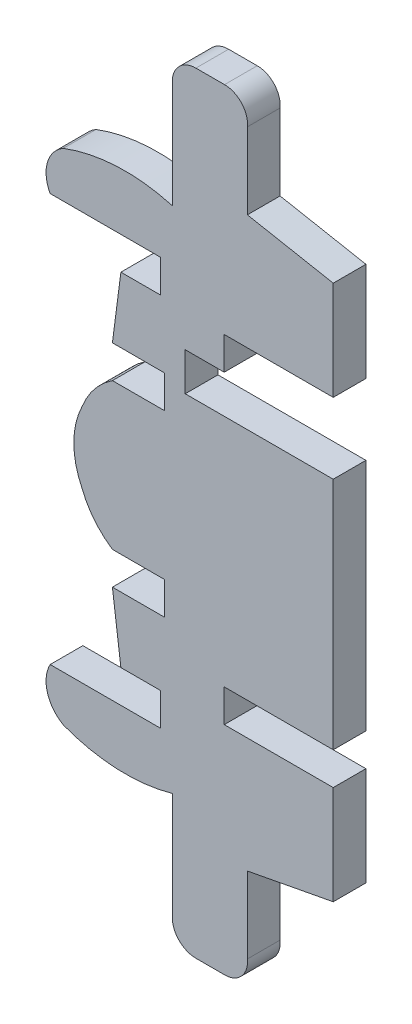
from build123d import *

# Parameters (mm, degrees)
BASE_EXTRUDE_DEPTH = 3


with BuildPart() as part:
    # Sketch1 → Base-Extrude (new body)
    with BuildSketch(Plane.XY):
        with BuildLine():
            Line((796.067430824, -94.790628806), (796.067430824, -97.790628806))
            Line((796.067430824, -97.790628806), (791.272591236, -97.790628806))
            ThreePointArc((791.272591236, -97.790628806), (789.599137263, -99.319974572), (788.471131564, -101.286430728))
            ThreePointArc((788.471131564, -101.286430728), (787.733624184, -104.495988694), (788.471131564, -107.705546661))
            ThreePointArc((788.471131564, -107.705546661), (789.599137263, -109.672002816), (791.272591236, -111.201348582))
            Line((791.272591236, -111.201348582), (796.067430824, -111.201348582))
            Line((796.067430824, -111.201348582), (796.067430824, -114.201348582))
            Line((796.067430824, -114.201348582), (791.272591236, -114.201348582))
            Line((791.272591236, -114.201348582), (792.051319906, -120.205546661))
            Line((792.051319906, -120.205546661), (795.668694327, -120.205546661))
            Line((795.668694327, -120.205546661), (795.668694327, -123.205546661))
            Line((795.668694327, -123.205546661), (785.561028396, -123.205546661))
            ThreePointArc((785.561028396, -123.205546661), (785.308371949, -125.550343576), (786.768988057, -127.401966768))
            ThreePointArc((786.768988057, -127.401966768), (791.730710774, -128.428848688), (796.763839141, -127.845069923))
            Line((796.763839141, -127.845069923), (796.763839141, -137.690530558))
            ThreePointArc((796.763839141, -137.690530558), (797.399275262, -139.224609057), (798.933353761, -139.860045178))
            Line((798.933353761, -139.860045178), (801.559237467, -139.860045178))
            ThreePointArc((801.559237467, -139.860045178), (803.122225358, -139.173347979), (803.657482492, -137.552242187))
            Line((803.657482492, -137.552242187), (803.657482492, -130.563057952))
            Line((803.657482492, -130.563057952), (811.531636536, -129.07193908))
            Line((811.531636536, -129.07193908), (811.531636536, -119.995988694))
            Line((811.531636536, -119.995988694), (801.531636536, -119.995988694))
            Line((801.531636536, -119.995988694), (801.531636536, -116.995988694))
            Line((801.531636536, -116.995988694), (811.531636536, -116.995988694))
            Line((811.531636536, -116.995988694), (811.531636536, -95.495988694))
            Line((811.531636536, -95.495988694), (797.954990923, -95.495988694))
            Line((797.954990923, -95.495988694), (797.954990923, -94.995988694))
            Line((797.954990923, -94.995988694), (797.954990923, -91.995988694))
            Line((797.954990923, -91.995988694), (801.531636536, -91.995988694))
            Line((801.531636536, -91.995988694), (801.531636536, -88.995988694))
            Line((801.531636536, -88.995988694), (811.531636536, -88.995988694))
            Line((811.531636536, -88.995988694), (811.531636536, -79.920038308))
            Line((811.531636536, -79.920038308), (803.657482492, -78.428919436))
            Line((803.657482492, -78.428919436), (803.657482492, -71.439735201))
            ThreePointArc((803.657482492, -71.439735201), (803.122225358, -69.818629409), (801.559237467, -69.131932211))
            Line((801.559237467, -69.131932211), (798.933353761, -69.131932211))
            ThreePointArc((798.933353761, -69.131932211), (797.399275262, -69.767368331), (796.763839141, -71.30144683))
            Line((796.763839141, -71.30144683), (796.763839141, -81.146907465))
            ThreePointArc((796.763839141, -81.146907465), (791.730710774, -80.5631287), (786.768988057, -81.590010621))
            ThreePointArc((786.768988057, -81.590010621), (785.308371949, -83.441633812), (785.561028396, -85.786430728))
            Line((785.561028396, -85.786430728), (795.668694327, -85.786430728))
            Line((795.668694327, -85.786430728), (795.668694327, -88.786430728))
            Line((795.668694327, -88.786430728), (792.051319906, -88.786430728))
            Line((792.051319906, -88.786430728), (791.272591236, -94.790628806))
            Line((791.272591236, -94.790628806), (796.067430824, -94.790628806))
        make_face()
    extrude(amount=BASE_EXTRUDE_DEPTH)


solid = part.part
